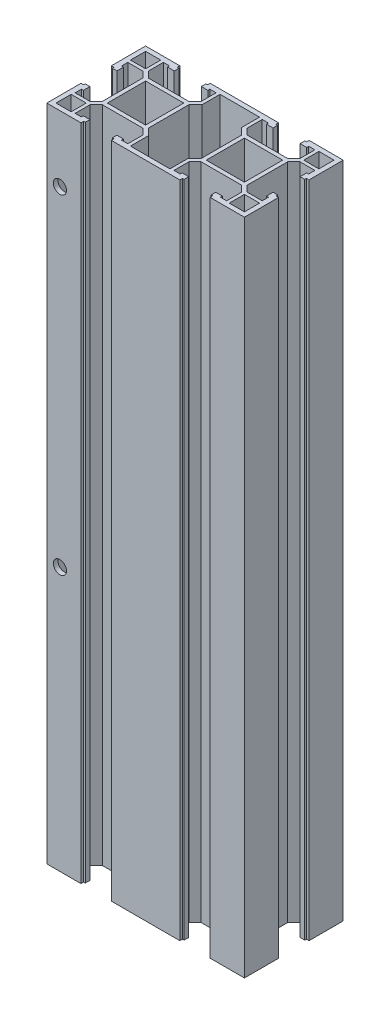
from build123d import *

# Parameters (mm, degrees)
SKETCH_1_W               = 14
SKETCH_1_H               = 14
SKETCH_1_W_2             = 11.6
SKETCH_1_H_2             = 11.6
SKETCH_1_W_3             = 4.6
SKETCH_1_H_3             = 4.6
EXTRUDE_2_DEPTH          = 200
CUT_EXTRUDE_1_DEPTH      = 203.792997907
CUT_EXTRUDE_1_DEPTH_BACK = 203.792997907
SKETCH_2_R               = 2


with BuildPart() as part:
    # Эскиз1 → Бобышка-Вытянуть2 (new body)
    # profile 1 of 9: a face of its own
    with BuildSketch(Plane(origin=(0, 0, 0), x_dir=(1, 0, 0), z_dir=(0, 1, 0))):
        Polygon((8, -7), (8, -6.151471863), (6, -8.151471863), (6, -13.6), (-6, -13.6), (-6, -8.151471863), (-8, -6.151471863), (-8, -7), (-8.848528137, -7), (-7, -8.848528137), (-7, -13.4), (-8.9, -13.4), (-8.9, -12.8), (-10.9, -12.8), (-10.9, -14.2), (-10.4, -14.2), (-10.4, -15), (10.4, -15), (10.4, -14.2), (10.9, -14.2), (10.9, -12.8), (8.9, -12.8), (8.9, -13.4), (7, -13.4), (7, -8.848528137), (8.848528137, -7), align=None)
    # profile 2 of 9: a face of its own
    with BuildSketch(Plane(origin=(0, 0, 0), x_dir=(1, 0, 0), z_dir=(0, 1, 0))):
        with Locations((-15, 0)):
            Rectangle(SKETCH_1_W, SKETCH_1_H)
        with Locations((-15, 0)):
            Rectangle(SKETCH_1_W_2, SKETCH_1_H_2, mode=Mode.SUBTRACT)
    # profile 3 of 9: a face of its own
    with BuildSketch(Plane(origin=(0, 0, 0), x_dir=(1, 0, 0), z_dir=(0, 1, 0))):
        Polygon((-23, -8.848528137), (-21.151471863, -7), (-22, -7), (-22, -6.151471863), (-23.848528137, -8), (-28.4, -8), (-28.4, -6.1), (-27.8, -6.1), (-27.8, -4.1), (-29.2, -4.1), (-29.2, -4.6), (-30, -4.6), (-30, -15), (-19.6, -15), (-19.6, -14.2), (-19.1, -14.2), (-19.1, -12.8), (-21.1, -12.8), (-21.1, -13.4), (-23, -13.4), align=None)
        with Locations((-26.3, -11.3)):
            Rectangle(SKETCH_1_W_3, SKETCH_1_H_3, mode=Mode.SUBTRACT)
    # profile 4 of 9: a face of its own
    with BuildSketch(Plane(origin=(0, 0, 0), x_dir=(1, 0, 0), z_dir=(0, 1, 0))):
        with Locations((15, 0)):
            Rectangle(SKETCH_1_W, SKETCH_1_H)
        with Locations((15, 0)):
            Rectangle(SKETCH_1_W_2, SKETCH_1_H_2, mode=Mode.SUBTRACT)
    # profile 5 of 9: a face of its own
    with BuildSketch(Plane(origin=(0, 0, 0), x_dir=(1, 0, 0), z_dir=(0, 1, 0))):
        Polygon((23.848528137, -8), (22, -6.151471863), (22, -7), (21.151471863, -7), (23, -8.848528137), (23, -13.4), (21.1, -13.4), (21.1, -12.8), (19.1, -12.8), (19.1, -14.2), (19.6, -14.2), (19.6, -15), (30, -15), (30, -4.6), (29.2, -4.6), (29.2, -4.1), (27.8, -4.1), (27.8, -6.1), (28.4, -6.1), (28.4, -8), align=None)
        with Locations((26.3, -11.3)):
            Rectangle(SKETCH_1_W_3, SKETCH_1_H_3, mode=Mode.SUBTRACT)
    # profile 6 of 9: a face of its own
    with BuildSketch(Plane(origin=(0, 0, 0), x_dir=(1, 0, 0), z_dir=(0, 1, 0))):
        Polygon((21.151471863, 7), (22, 7), (22, 6.151471863), (23.848528137, 8), (28.4, 8), (28.4, 6.1), (27.8, 6.1), (27.8, 4.1), (29.2, 4.1), (29.2, 4.6), (30, 4.6), (30, 15), (19.6, 15), (19.6, 14.2), (19.1, 14.2), (19.1, 12.8), (21.1, 12.8), (21.1, 13.4), (23, 13.4), (23, 8.848528137), align=None)
        with Locations((26.3, 11.3)):
            Rectangle(SKETCH_1_W_3, SKETCH_1_H_3, mode=Mode.SUBTRACT)
    # profile 7 of 9: a face of its own
    with BuildSketch(Plane(origin=(0, 0, 0), x_dir=(1, 0, 0), z_dir=(0, 1, 0))):
        Polygon((8, 7), (8.848528137, 7), (7, 8.848528137), (7, 13.4), (8.9, 13.4), (8.9, 12.8), (10.9, 12.8), (10.9, 14.2), (10.4, 14.2), (10.4, 15), (-10.4, 15), (-10.4, 14.2), (-10.9, 14.2), (-10.9, 12.8), (-8.9, 12.8), (-8.9, 13.4), (-7, 13.4), (-7, 8.848528137), (-8.848528137, 7), (-8, 7), (-8, 6.151471863), (-6, 8.151471863), (-6, 13.6), (6, 13.6), (6, 8.151471863), (8, 6.151471863), align=None)
    # profile 8 of 9: a face of its own
    with BuildSketch(Plane(origin=(0, 0, 0), x_dir=(1, 0, 0), z_dir=(0, 1, 0))):
        Polygon((-22, 7), (-21.151471863, 7), (-23, 8.848528137), (-23, 13.4), (-21.1, 13.4), (-21.1, 12.8), (-19.1, 12.8), (-19.1, 14.2), (-19.6, 14.2), (-19.6, 15), (-30, 15), (-30, 13.6), (-28.6, 13.6), (-24, 13.6), (-24, 9), (-24, 8.151471863), (-23.848528137, 8), (-22, 6.151471863), align=None)
    # profile 9 of 9: a face of its own
    with BuildSketch(Plane(origin=(0, 0, 0), x_dir=(1, 0, 0), z_dir=(0, 1, 0))):
        Polygon((-28.6, 13.6), (-30, 13.6), (-30, 4.6), (-29.2, 4.6), (-29.2, 4.1), (-27.8, 4.1), (-27.8, 6.1), (-28.4, 6.1), (-28.4, 8), (-23.848528137, 8), (-24, 8.151471863), (-24, 9), (-28.6, 9), align=None)
    extrude(amount=EXTRUDE_2_DEPTH)

    # Эскиз2 → Вырез-Вытянуть1 (cut, two sides: drawn at the far end of the back side and taken through both)
    with BuildSketch(Plane.XY.offset(-CUT_EXTRUDE_1_DEPTH_BACK)):
        with Locations((-26, 180)):
            Circle(SKETCH_2_R)
        with Locations((-26, 80)):
            Circle(SKETCH_2_R)
    extrude(amount=CUT_EXTRUDE_1_DEPTH + CUT_EXTRUDE_1_DEPTH_BACK, mode=Mode.SUBTRACT)


solid = part.part
